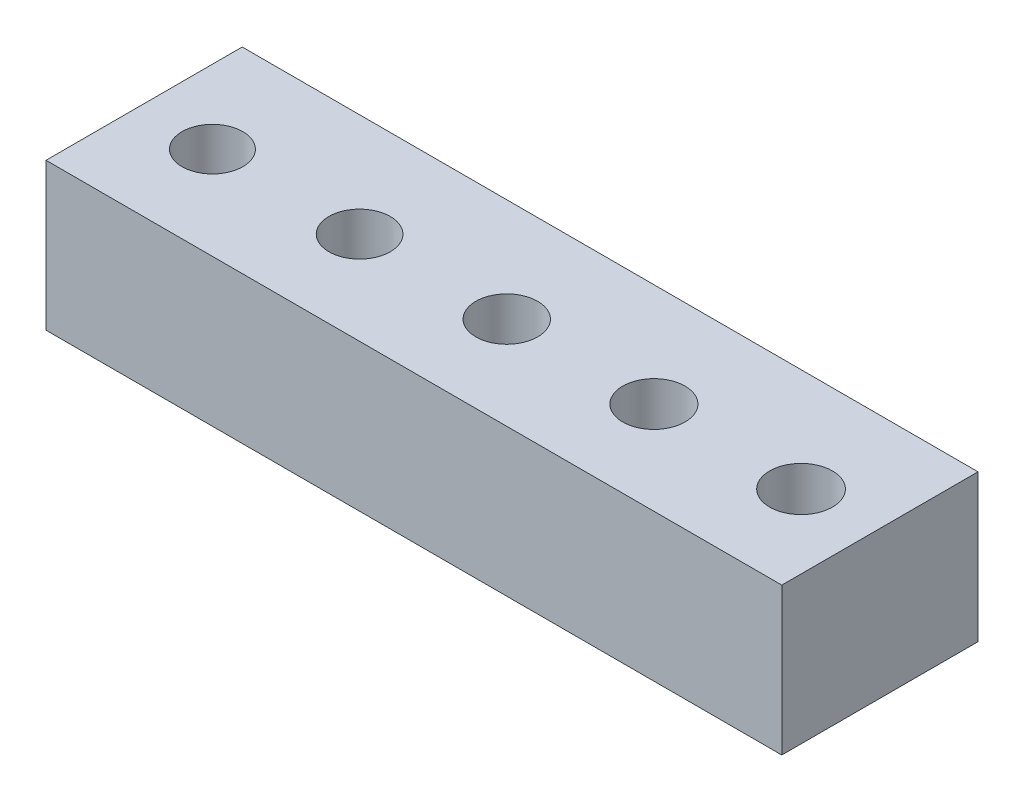
from build123d import *

# Parameters (mm, degrees)
SKETCH3_W           = 38.1
SKETCH3_H           = 10.16
BOSS_EXTRUDE2_DEPTH = 7.62
CUT_EXTRUDE1_START  = 7.62
SKETCH1_R           = 1.5748
SKETCH1_R_2         = 1.5875
SKETCH1_R_3         = 1.6002
SKETCH1_R_4         = 1.6129
SKETCH1_R_5         = 1.6256
CUT_EXTRUDE1_DEPTH  = 4.7498


with BuildPart() as part:
    # Sketch3 → Boss-Extrude2 (new body)
    with BuildSketch(Plane(origin=(0, 0, 0), x_dir=(1, 0, 0), z_dir=(0, 1, 0))):
        with Locations((19.05, 5.08)):
            Rectangle(SKETCH3_W, SKETCH3_H)
    extrude(amount=BOSS_EXTRUDE2_DEPTH)

    # Sketch1 → Cut-Extrude1 (cut)
    with BuildSketch(Plane(origin=(0, 0, 0), x_dir=(1, 0, 0), z_dir=(0, 1, 0)).offset(CUT_EXTRUDE1_START)):
        with Locations(Location((3.81, 4.807346471, 0), (0, 0, 90))):
            Circle(SKETCH1_R)
        with Locations(Location((11.43, 4.807346471, 0), (0, 0, 90))):
            Circle(SKETCH1_R_2)
        with Locations(Location((19.05, 4.807346471, 0), (0, 0, 90))):
            Circle(SKETCH1_R_3)
        with Locations(Location((26.67, 4.807346471, 0), (0, 0, 90))):
            Circle(SKETCH1_R_4)
        with Locations(Location((34.29, 4.807346471, 0), (0, 0, 90))):
            Circle(SKETCH1_R_5)
    extrude(amount=-CUT_EXTRUDE1_DEPTH, mode=Mode.SUBTRACT)


solid = part.part
